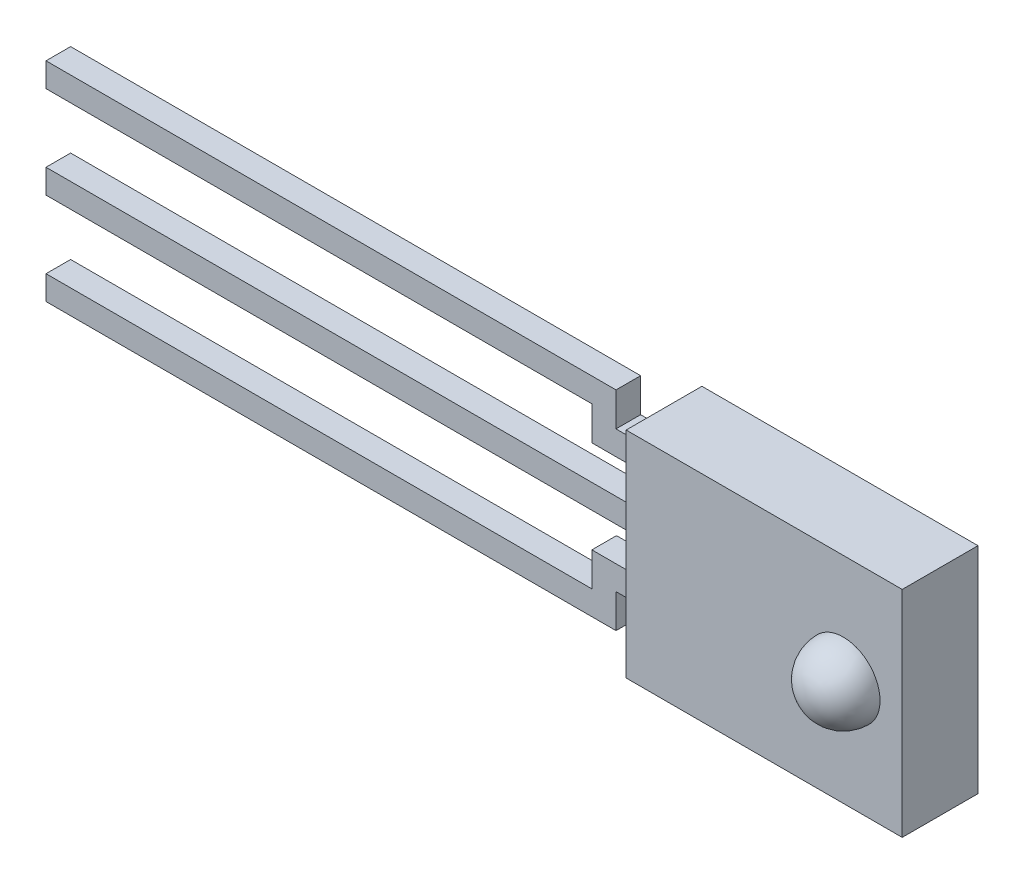
from build123d import *

# Parameters (mm, degrees)
ESQUISSE1_W        = 5.72
ESQUISSE1_H        = 4.45
BOSS_EXTRU_1_DEPTH = 1.57
BOSS_EXTRU_2_START = -0.68
BOSS_EXTRU_2_DEPTH = 0.51
ESQUISSE4_W        = 12.7
ESQUISSE4_H        = 0.5
BOSS_EXTRU_3_DEPTH = 0.51


with BuildPart() as part:
    # Esquisse1 → Boss.-Extru.1 (new body)
    with BuildSketch(Plane.XY):
        with Locations((-1.64, 0)):
            Rectangle(ESQUISSE1_W, ESQUISSE1_H)
    extrude(amount=BOSS_EXTRU_1_DEPTH)

    # Esquisse2 → Révolution5 (revolve)
    with BuildSketch(Plane(origin=(0, 0, 0), x_dir=(1, 0, 0), z_dir=(0, 1, 0))):
        with BuildLine():
            Line((0, -0.81), (0, -2.33))
            ThreePointArc((0, -2.33), (0.76, -1.57), (0, -0.81))
        make_face()
    revolve(axis=Axis((0, 0, 0), (0, 0, 1)))

    # Esquisse3 → Boss.-Extru.2 (add)
    with BuildSketch(Plane.XY.offset(1.57).offset(BOSS_EXTRU_2_START)):
        Polygon((-4.5, 1.46), (-5.39, 1.46), (-5.39, 2.16), (-17.2, 2.16), (-17.2, 1.66), (-5.89, 1.66), (-5.89, 0.96), (-4.5, 0.96), align=None)
    boss_extru_2 = extrude(amount=-BOSS_EXTRU_2_DEPTH)

    # Symétrie1: Boss.-Extru.2 across plane
    add(boss_extru_2.mirror(Plane.ZX))

    # Esquisse4 → Boss.-Extru.3 (add)
    with BuildSketch(Plane.XY.offset(0.89)):
        with Locations((-10.85, 0)):
            Rectangle(ESQUISSE4_W, ESQUISSE4_H)
    extrude(amount=-BOSS_EXTRU_3_DEPTH)


solid = part.part
